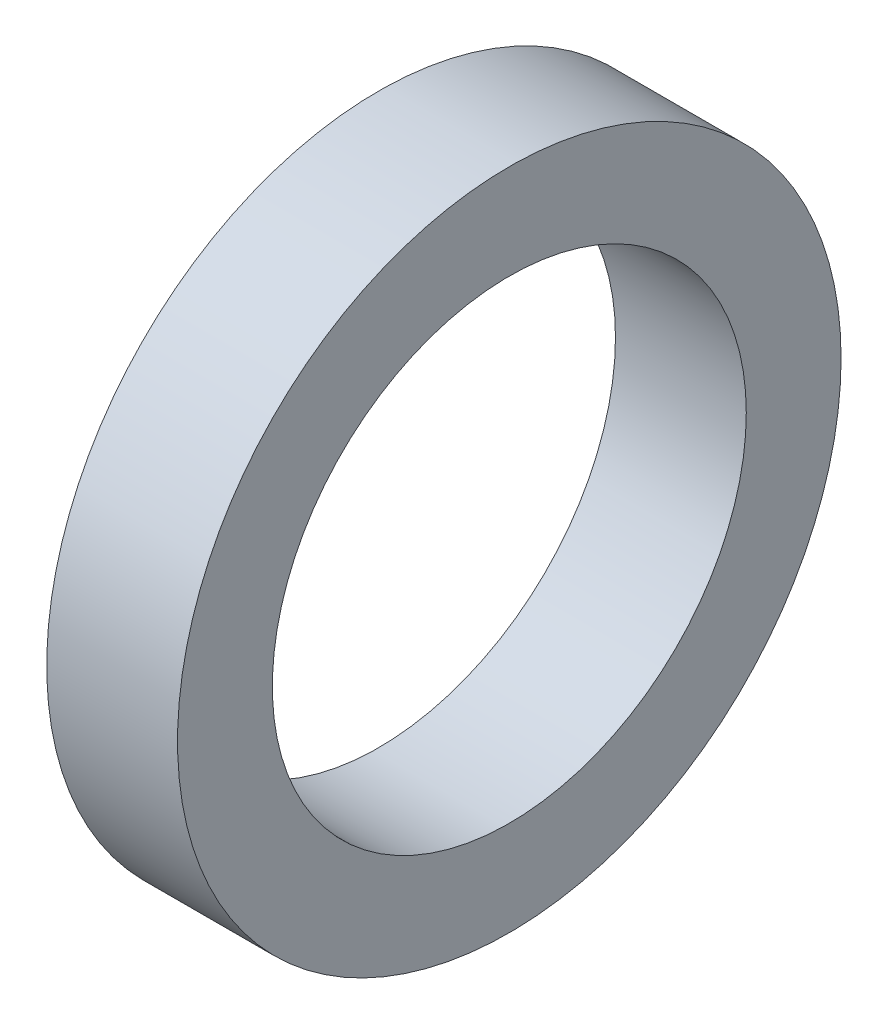
from build123d import *

# Parameters (mm, degrees)
SKETCH1_R           = 8.89
SKETCH1_R_2         = 6.35
BOSS_EXTRUDE1_DEPTH = 3.5052


with BuildPart() as part:
    # Sketch1 → Boss-Extrude1 (new body)
    with BuildSketch(Plane(origin=(0, 0, 0), x_dir=(0, 0, -1), z_dir=(1, 0, 0))):
        Circle(SKETCH1_R)
        Circle(SKETCH1_R_2, mode=Mode.SUBTRACT)
    extrude(amount=BOSS_EXTRUDE1_DEPTH)


solid = part.part
